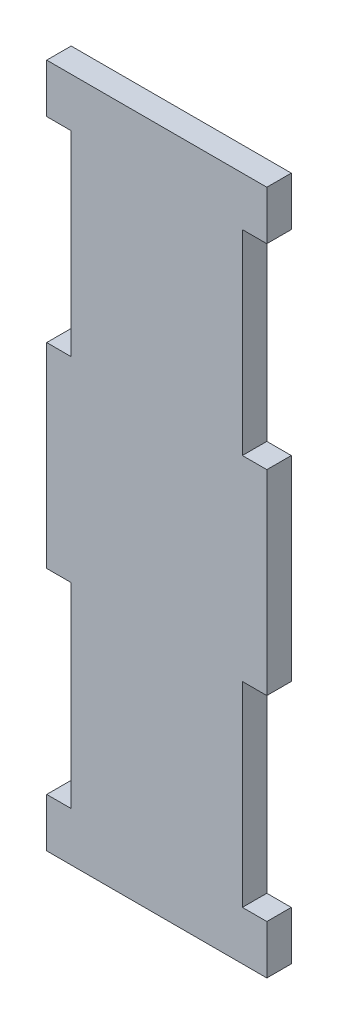
from build123d import *

# Parameters (mm, degrees)
BOSS_EXTRU_1_DEPTH = 10


with BuildPart() as part:
    # Esquisse1 → Boss.-Extru.1 (new body)
    with BuildSketch(Plane.XY):
        Polygon((0, 0), (90, 0), (90, 20), (80, 20), (80, 100), (90, 100), (90, 180), (80, 180), (80, 260), (90, 260), (90, 280), (0, 280), (0, 260), (10, 260), (10, 180), (0, 180), (0, 100), (10, 100), (10, 20), (0, 20), align=None)
    extrude(amount=BOSS_EXTRU_1_DEPTH)


solid = part.part
